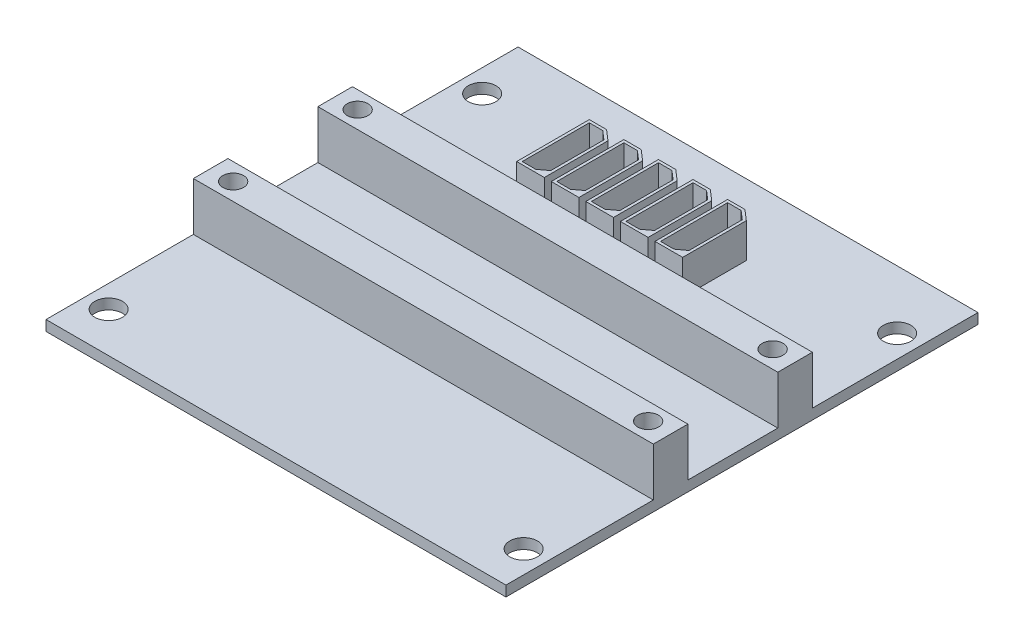
from build123d import *

# Parameters (mm, degrees)
SKETCH1_W               = 66.5
SKETCH1_H               = 68.25
BOSS_EXTRUDE1_DEPTH     = 1.5
CUT_EXTRUDE1_DEPTH      = 48.668942982
CUT_EXTRUDE1_DEPTH_BACK = 48.668942982
SKETCH3_R               = 2
SKETCH3_R_2             = 1.5
BOSS_EXTRUDE2_DEPTH     = 5
SKETCH6_W               = 66.5
SKETCH6_H               = 5
BOSS_EXTRUDE3_DEPTH     = 7
CUT_EXTRUDE2_DEPTH      = 49.397604538
CUT_EXTRUDE2_DEPTH_BACK = 49.397604538
SKETCH7_R               = 1.5


with BuildPart() as part:
    # Sketch1 → Boss-Extrude1 (new body)
    with BuildSketch(Plane(origin=(0, 0, 0), x_dir=(1, 0, 0), z_dir=(0, 1, 0))):
        Rectangle(SKETCH1_W, SKETCH1_H)
    extrude(amount=BOSS_EXTRUDE1_DEPTH)

    # Sketch3 → Cut-Extrude1 (cut, two sides: drawn at the far end of the back side and taken through both)
    with BuildSketch(Plane(origin=(0, 1.5, 0), x_dir=(1, 0, 0), z_dir=(0, 1, 0)).offset(-CUT_EXTRUDE1_DEPTH_BACK)):
        with Locations(Location((-30, -28.317585536, 0), (0, 0, 270))):
            Circle(SKETCH3_R)
        with Locations(Location((30, -28.317585536, 0), (0, 0, 270))):
            Circle(SKETCH3_R)
        with Locations(Location((30, 25.682414464, 0), (0, 0, 270))):
            Circle(SKETCH3_R)
        with Locations(Location((-30, 25.682414464, 0), (0, 0, 270))):
            Circle(SKETCH3_R)
        with Locations(Location((30, 7.682414464, 0), (0, 0, 270))):
            Circle(SKETCH3_R_2)
        with Locations(Location((30, -10.317585536, 0), (0, 0, 270))):
            Circle(SKETCH3_R_2)
        with Locations(Location((-30, -10.317585536, 0), (0, 0, 270))):
            Circle(SKETCH3_R_2)
        with Locations(Location((-30, 7.682414464, 0), (0, 0, 270))):
            Circle(SKETCH3_R_2)
    extrude(amount=CUT_EXTRUDE1_DEPTH + CUT_EXTRUDE1_DEPTH_BACK, mode=Mode.SUBTRACT)

    # Sketch5 → Boss-Extrude2 (add)
    # profile 1 of 5: a face of its own
    with BuildSketch(Plane(origin=(0, 1.5, 0), x_dir=(1, 0, 0), z_dir=(0, 1, 0))):
        Polygon((-14.006270714, 25.182414464), (-11.506270714, 25.182414464), (-10.006270714, 23.882414464), (-10.006270714, 14.682414464), (-14.006270714, 14.682414464), align=None)
        Polygon((-10.406270714, 23.699762911), (-10.406270714, 15.999762911), (-11.656270714, 15.082414464), (-13.606270714, 15.082414464), (-13.606270714, 24.782414464), (-11.655484044, 24.782414464), align=None, mode=Mode.SUBTRACT)
    # profile 2 of 5: a face of its own
    with BuildSketch(Plane(origin=(0, 1.5, 0), x_dir=(1, 0, 0), z_dir=(0, 1, 0))):
        Polygon((-9.006270714, 25.182414464), (-6.506270714, 25.182414464), (-5.006270714, 23.882414464), (-5.006270714, 14.682414464), (-9.006270714, 14.682414464), align=None)
        Polygon((-5.406270714, 23.699762911), (-5.406270714, 15.999762911), (-6.656270714, 15.082414464), (-8.606270714, 15.082414464), (-8.606270714, 24.782414464), (-6.655484044, 24.782414464), align=None, mode=Mode.SUBTRACT)
    # profile 3 of 5: a face of its own
    with BuildSketch(Plane(origin=(0, 1.5, 0), x_dir=(1, 0, 0), z_dir=(0, 1, 0))):
        Polygon((-4.006270714, 25.182414464), (-1.506270714, 25.182414464), (-0.006270714, 23.882414464), (-0.006270714, 14.682414464), (-4.006270714, 14.682414464), align=None)
        Polygon((-0.406270714, 23.699762911), (-0.406270714, 15.999762911), (-1.656270714, 15.082414464), (-3.606270714, 15.082414464), (-3.606270714, 24.782414464), (-1.655484044, 24.782414464), align=None, mode=Mode.SUBTRACT)
    # profile 4 of 5: a face of its own
    with BuildSketch(Plane(origin=(0, 1.5, 0), x_dir=(1, 0, 0), z_dir=(0, 1, 0))):
        Polygon((0.993729286, 25.182414464), (3.493729286, 25.182414464), (4.993729286, 23.882414464), (4.993729286, 14.682414464), (0.993729286, 14.682414464), align=None)
        Polygon((4.593729286, 23.699762911), (4.593729286, 15.999762911), (3.343729286, 15.082414464), (1.393729286, 15.082414464), (1.393729286, 24.782414464), (3.344515956, 24.782414464), align=None, mode=Mode.SUBTRACT)
    # profile 5 of 5: a face of its own
    with BuildSketch(Plane(origin=(0, 1.5, 0), x_dir=(1, 0, 0), z_dir=(0, 1, 0))):
        Polygon((5.993729286, 25.182414464), (8.493729286, 25.182414464), (9.993729286, 23.882414464), (9.993729286, 14.682414464), (5.993729286, 14.682414464), align=None)
        Polygon((9.593729286, 23.699762911), (9.593729286, 15.999762911), (8.343729286, 15.082414464), (6.393729286, 15.082414464), (6.393729286, 24.782414464), (8.344515956, 24.782414464), align=None, mode=Mode.SUBTRACT)
    extrude(amount=BOSS_EXTRUDE2_DEPTH)

    # Sketch6 → Boss-Extrude3 (add)
    with BuildSketch(Plane(origin=(0, 1.5, 0), x_dir=(1, 0, 0), z_dir=(0, 1, 0))):
        with Locations((0, 7.682414464)):
            Rectangle(SKETCH6_W, SKETCH6_H)
        with Locations((0, -10.317585536)):
            Rectangle(SKETCH6_W, SKETCH6_H)
    extrude(amount=BOSS_EXTRUDE3_DEPTH)

    # Sketch7 → Cut-Extrude2 (cut, two sides: drawn at the far end of the back side and taken through both)
    with BuildSketch(Plane(origin=(0, 8.5, 0), x_dir=(1, 0, 0), z_dir=(0, 1, 0)).offset(-CUT_EXTRUDE2_DEPTH_BACK)):
        with Locations(Location((-30, 7.682414464, 0), (0, 0, 270))):
            Circle(SKETCH7_R)
        with Locations(Location((-30, -10.317585536, 0), (0, 0, 270))):
            Circle(SKETCH7_R)
        with Locations(Location((30, -10.317585536, 0), (0, 0, 270))):
            Circle(SKETCH7_R)
        with Locations(Location((30, 7.682414464, 0), (0, 0, 270))):
            Circle(SKETCH7_R)
    extrude(amount=CUT_EXTRUDE2_DEPTH + CUT_EXTRUDE2_DEPTH_BACK, mode=Mode.SUBTRACT)


solid = part.part
